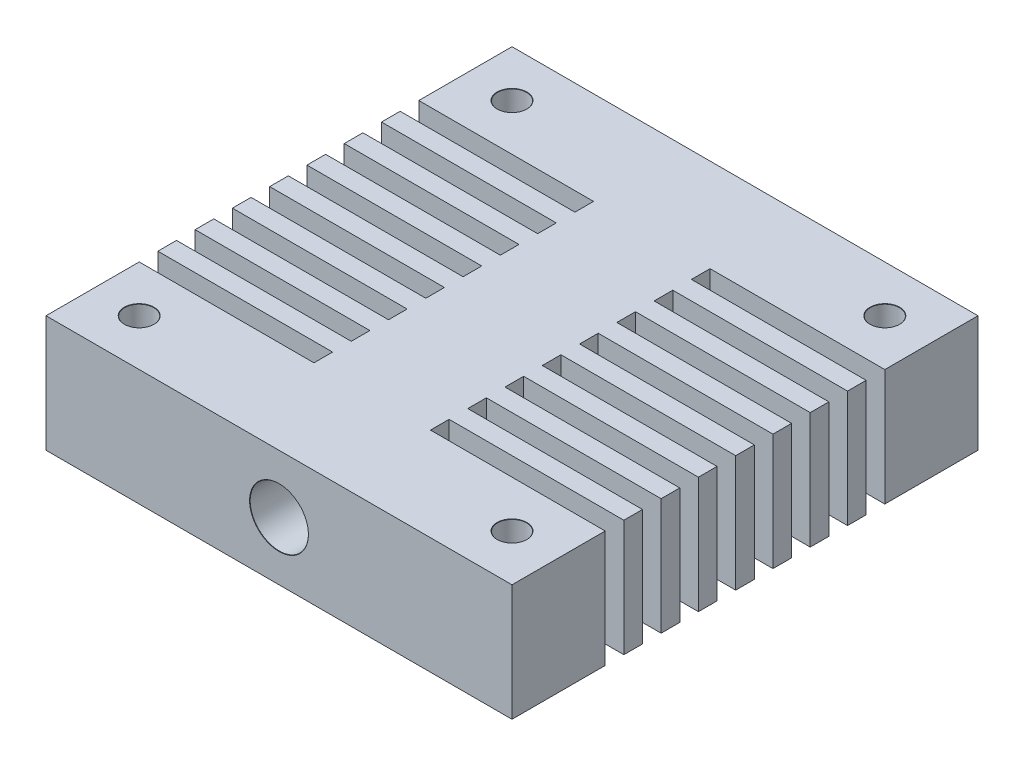
from build123d import *

# Parameters (mm, degrees)
ESQUISSE1_W                                         = 40
ESQUISSE1_H                                         = 40
BOSS_EXTRU_1_DEPTH                                  = 10
DIAM_TRE_DU_PER_AGE_4_0_4_1_D                       = 4
TROU_POUR_TARAUDAGE_POUR_TROU_TARAUD_M6_D           = 5
TROU_POUR_TARAUDAGE_POUR_TROU_TARAUD_M6_DEPTH       = 8
TROU_POUR_TARAUDAGE_POUR_TROU_TARAUD_M6_CSINK_D     = 5.05
TROU_POUR_TARAUDAGE_POUR_TROU_TARAUD_M6_CSINK_ANGLE = 90
TROU_POUR_TARAUDAGE_POUR_TROU_TARAUD_M6_TIP         = 1.502151548
DIAM_TRE_DU_PER_AGE_6_0_6_1_D                       = 6
DIAM_TRE_DU_PER_AGE_6_0_6_1_DEPTH                   = 20
DIAM_TRE_DU_PER_AGE_6_0_6_1_TIP                     = 1.802581857
TROU_POUR_TARAUDAGE_POUR_TROU_TARAUD_2_COUNT        = 2
TROU_POUR_TARAUDAGE_POUR_TROU_TARAUD_2_PITCH        = 32
TROU_POUR_TARAUDAGE_POUR_TROU_TARAUD_3_COUNT        = 2
TROU_POUR_TARAUDAGE_POUR_TROU_TARAUD_3_PITCH        = 45.254833996
TROU_POUR_TARAUDAGE_POUR_TROU_TARAUD_4_COUNT        = 2
TROU_POUR_TARAUDAGE_POUR_TROU_TARAUD_4_PITCH        = 32
TROU_POUR_TARAUDAGE_POUR_TROU_TARAUD_5_D            = 2.5
TROU_POUR_TARAUDAGE_POUR_TROU_TARAUD_5_DEPTH        = 5
TROU_POUR_TARAUDAGE_POUR_TROU_TARAUD_5_CSINK_D      = 2.55
TROU_POUR_TARAUDAGE_POUR_TROU_TARAUD_5_CSINK_ANGLE  = 90
TROU_POUR_TARAUDAGE_POUR_TROU_TARAUD_5_TIP          = 0.751075774
ESQUISSE21_W                                        = 15
ESQUISSE21_H                                        = 1.6
ENL_V_MAT_EXTRU_1_DEPTH                             = 58.445626535
R_P_TITION_LIN_AIRE1_COUNT                          = 8
R_P_TITION_LIN_AIRE1_PITCH                          = 3.2


with BuildPart() as part:
    # Esquisse1 → Boss.-Extru.1 (new body)
    with BuildSketch(Plane(origin=(0, 0, 0), x_dir=(1, 0, 0), z_dir=(0, 1, 0))):
        with Locations((20, 20)):
            Rectangle(ESQUISSE1_W, ESQUISSE1_H)
    extrude(amount=BOSS_EXTRU_1_DEPTH)

    # Diamètre du perçage Ø4.0 (4)1 (through all)
    with Locations(Plane.XY):
        with Locations((20, 5)):
            Hole(DIAM_TRE_DU_PER_AGE_4_0_4_1_D / 2)

    # Trou pour taraudage pour trou taraudé M61
    with Locations(Plane.XY):
        with Locations((20, 5)):
            CounterSinkHole(TROU_POUR_TARAUDAGE_POUR_TROU_TARAUD_M6_D / 2, TROU_POUR_TARAUDAGE_POUR_TROU_TARAUD_M6_CSINK_D / 2, depth=TROU_POUR_TARAUDAGE_POUR_TROU_TARAUD_M6_DEPTH, counter_sink_angle=TROU_POUR_TARAUDAGE_POUR_TROU_TARAUD_M6_CSINK_ANGLE)
            with Locations((0, 0, -(TROU_POUR_TARAUDAGE_POUR_TROU_TARAUD_M6_DEPTH + TROU_POUR_TARAUDAGE_POUR_TROU_TARAUD_M6_TIP / 2))):  # 118° drill point
                Cone(0, TROU_POUR_TARAUDAGE_POUR_TROU_TARAUD_M6_D / 2, TROU_POUR_TARAUDAGE_POUR_TROU_TARAUD_M6_TIP, mode=Mode.SUBTRACT)

    # Diamètre du perçage Ø6.0 (6)1
    with Locations(Plane(origin=(0, 0, -40), x_dir=(-1, 0, 0), z_dir=(0, 0, -1))):
        with Locations((-20, 5)):
            Hole(DIAM_TRE_DU_PER_AGE_6_0_6_1_D / 2, depth=DIAM_TRE_DU_PER_AGE_6_0_6_1_DEPTH)
            with Locations((0, 0, -(DIAM_TRE_DU_PER_AGE_6_0_6_1_DEPTH + DIAM_TRE_DU_PER_AGE_6_0_6_1_TIP / 2))):  # 118° drill point
                Cone(0, DIAM_TRE_DU_PER_AGE_6_0_6_1_D / 2, DIAM_TRE_DU_PER_AGE_6_0_6_1_TIP, mode=Mode.SUBTRACT)

    # Esquisse17 → Trou pour taraudage pour trou taraud_ M3 (revolve, cut)
    with BuildSketch(Plane(origin=(4, 0, -4), x_dir=(0, 0, -1), z_dir=(1, 0, 0))):
        Polygon((0, 0), (0, 10), (1.275, 10), (1.25, 9.975), (1.25, 0.025), (1.275, 0), align=None)
    trou_pour_taraudage_pour_trou_taraud_m3 = revolve(axis=Axis((4, -6.35, -4), (0, 1, 0)), mode=Mode.SUBTRACT)

    # Trou pour taraudage pour trou taraud 2: Trou pour taraudage pour trou taraud_ M3 ×2
    with Locations(*[(i * TROU_POUR_TARAUDAGE_POUR_TROU_TARAUD_2_PITCH, 0, 0) for i in range(1, TROU_POUR_TARAUDAGE_POUR_TROU_TARAUD_2_COUNT)]):
        add(trou_pour_taraudage_pour_trou_taraud_m3, mode=Mode.SUBTRACT)

    # Trou pour taraudage pour trou taraud 3: Trou pour taraudage pour trou taraud_ M3 ×2
    with Locations(*[Vector(0.7071067811865475, 0, -0.7071067811865476) * (i * TROU_POUR_TARAUDAGE_POUR_TROU_TARAUD_3_PITCH) for i in range(1, TROU_POUR_TARAUDAGE_POUR_TROU_TARAUD_3_COUNT)]):
        add(trou_pour_taraudage_pour_trou_taraud_m3, mode=Mode.SUBTRACT)

    # Trou pour taraudage pour trou taraud 4: Trou pour taraudage pour trou taraud_ M3 ×2
    with Locations(*[(0, 0, -i * TROU_POUR_TARAUDAGE_POUR_TROU_TARAUD_4_PITCH) for i in range(1, TROU_POUR_TARAUDAGE_POUR_TROU_TARAUD_4_COUNT)]):
        add(trou_pour_taraudage_pour_trou_taraud_m3, mode=Mode.SUBTRACT)

    # Trou pour taraudage pour trou taraud 5
    with Locations(Plane(origin=(0, 0, 0), x_dir=(-1, 0, 0), z_dir=(0, -1, 0))):
        with Locations((-20, 36)):
            CounterSinkHole(TROU_POUR_TARAUDAGE_POUR_TROU_TARAUD_5_D / 2, TROU_POUR_TARAUDAGE_POUR_TROU_TARAUD_5_CSINK_D / 2, depth=TROU_POUR_TARAUDAGE_POUR_TROU_TARAUD_5_DEPTH, counter_sink_angle=TROU_POUR_TARAUDAGE_POUR_TROU_TARAUD_5_CSINK_ANGLE)
            with Locations((0, 0, -(TROU_POUR_TARAUDAGE_POUR_TROU_TARAUD_5_DEPTH + TROU_POUR_TARAUDAGE_POUR_TROU_TARAUD_5_TIP / 2))):  # 118° drill point
                Cone(0, TROU_POUR_TARAUDAGE_POUR_TROU_TARAUD_5_D / 2, TROU_POUR_TARAUDAGE_POUR_TROU_TARAUD_5_TIP, mode=Mode.SUBTRACT)

    # Esquisse21 → Enlèv. mat.-Extru.1 (cut, through all)
    with BuildSketch(Plane.XZ):
        with Locations((7.5, -8.8)):
            Rectangle(ESQUISSE21_W, ESQUISSE21_H)
        with Locations((32.5, -8.8)):
            Rectangle(ESQUISSE21_W, ESQUISSE21_H)
    enl_v_mat_extru_1 = extrude(amount=-ENL_V_MAT_EXTRU_1_DEPTH, mode=Mode.SUBTRACT)

    # Répétition linéaire1: Enlèv. mat.-Extru.1 ×8
    with Locations(*[(0, 0, -i * R_P_TITION_LIN_AIRE1_PITCH) for i in range(1, R_P_TITION_LIN_AIRE1_COUNT)]):
        add(enl_v_mat_extru_1, mode=Mode.SUBTRACT)


solid = part.part
